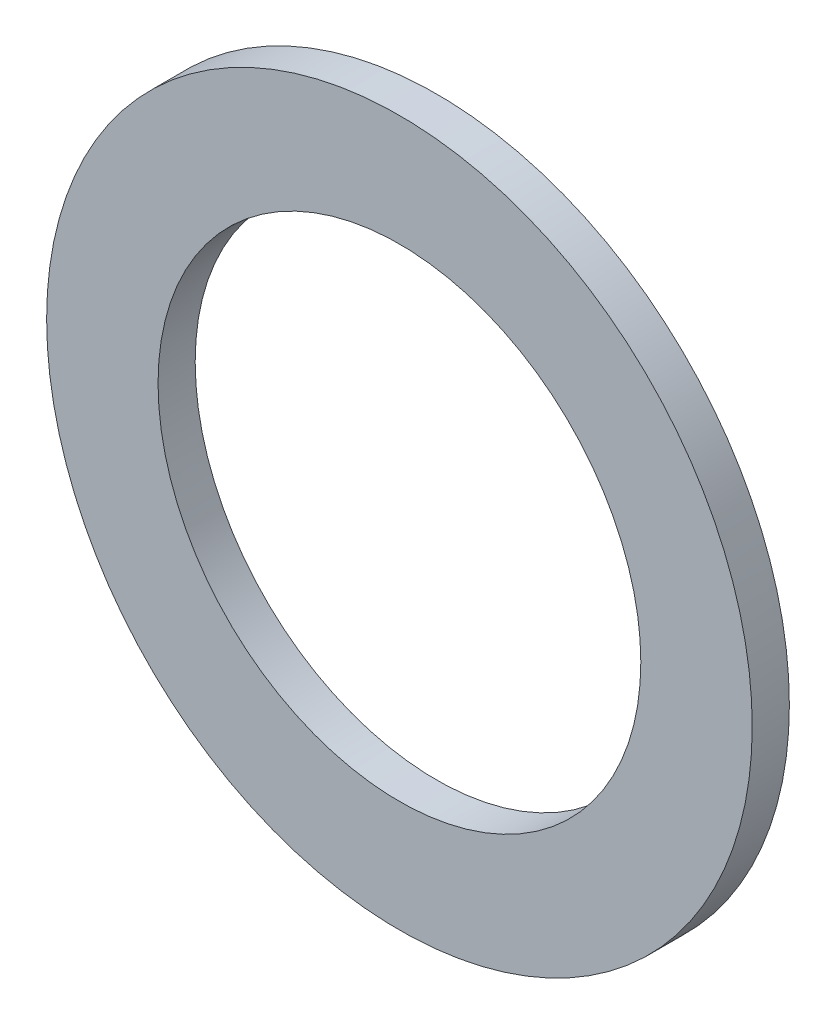
from build123d import *

# Parameters (mm, degrees)
SKETCH1_R           = 9.5
SKETCH1_R_2         = 6.5
BOSS_EXTRUDE1_DEPTH = 1


with BuildPart() as part:
    # Sketch1 → Boss-Extrude1 (new body)
    with BuildSketch(Plane.XY):
        Circle(SKETCH1_R)
        Circle(SKETCH1_R_2, mode=Mode.SUBTRACT)
    extrude(amount=BOSS_EXTRUDE1_DEPTH)


solid = part.part
